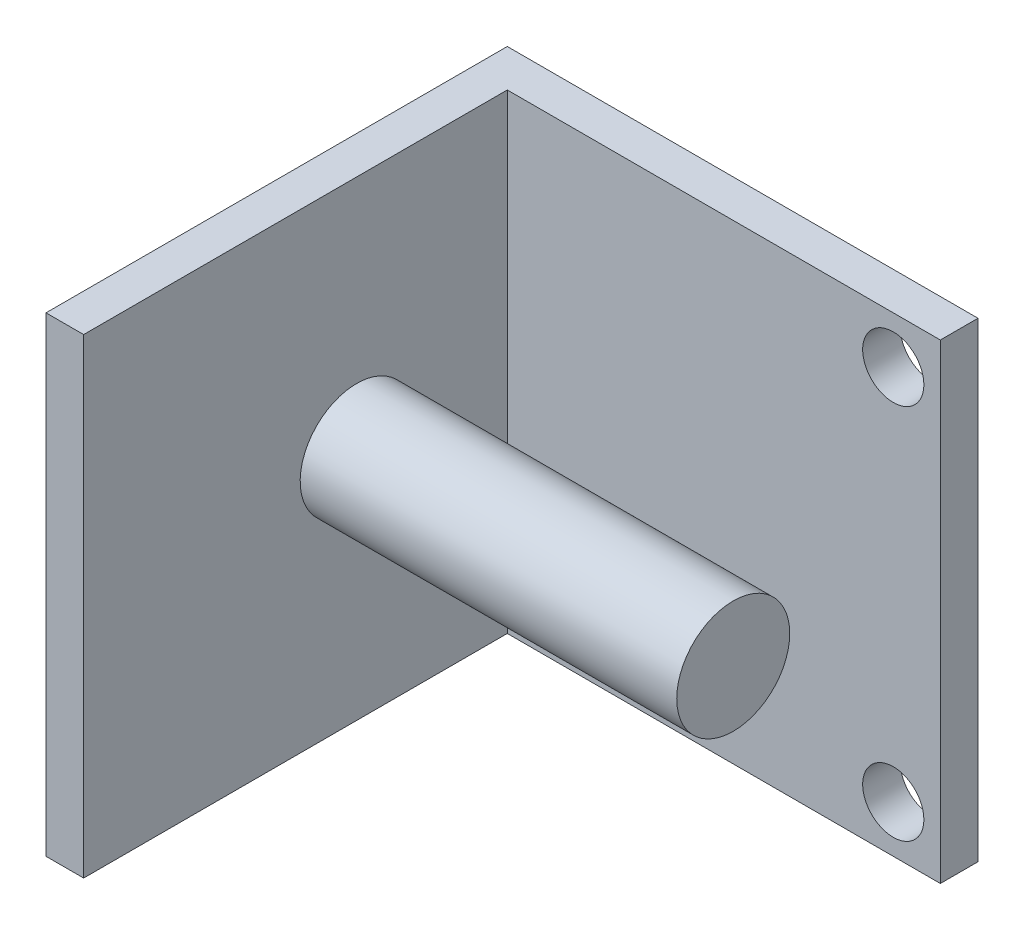
from build123d import *

# Parameters (mm, degrees)
SKETCH1_W           = 50
SKETCH1_H           = 50
BOSS_EXTRUDE1_DEPTH = 4
SKETCH2_W           = 4
SKETCH2_H           = 50
BOSS_EXTRUDE2_DEPTH = 45
SKETCH4_R           = 6
BOSS_EXTRUDE3_DEPTH = 40
SKETCH5_R           = 3.25
CUT_EXTRUDE1_DEPTH  = 40


with BuildPart() as part:
    # Sketch1 → Boss-Extrude1 (new body)
    with BuildSketch(Plane.XY):
        Rectangle(SKETCH1_W, SKETCH1_H)
    extrude(amount=BOSS_EXTRUDE1_DEPTH)

    # Sketch2 → Boss-Extrude2 (add)
    with BuildSketch(Plane.XY.offset(4)):
        with Locations((-23, 0)):
            Rectangle(SKETCH2_W, SKETCH2_H)
    extrude(amount=BOSS_EXTRUDE2_DEPTH)

    # Sketch4 → Boss-Extrude3 (add)
    with BuildSketch(Plane(origin=(-21, 0, 0), x_dir=(0, 0, -1), z_dir=(1, 0, 0))):
        with Locations(Location((-20, 0, 0), (0, 0, 270))):
            Circle(SKETCH4_R)
    extrude(amount=BOSS_EXTRUDE3_DEPTH)

    # Sketch5 → Cut-Extrude1 (cut)
    with BuildSketch(Plane.XY.offset(4)):
        with Locations((20, 20)):
            Circle(SKETCH5_R)
        with Locations((20, -20)):
            Circle(SKETCH5_R)
    extrude(amount=-CUT_EXTRUDE1_DEPTH, mode=Mode.SUBTRACT)


solid = part.part
